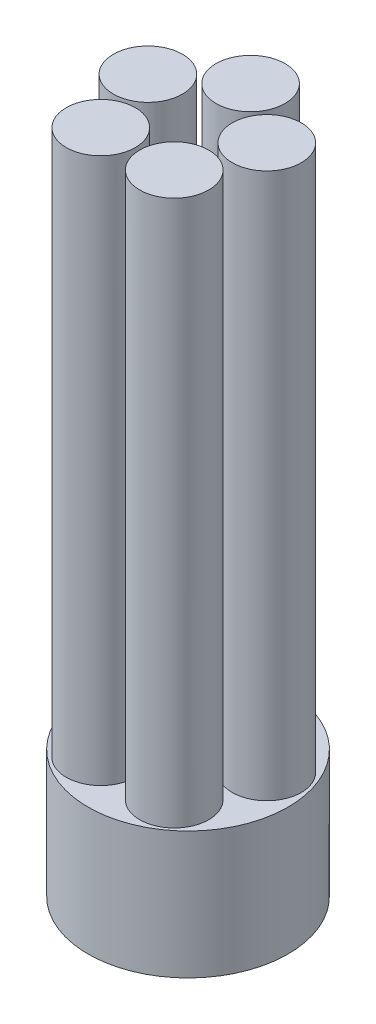
from build123d import *

# Parameters (mm, degrees)
SKETCH1_R             = 38
BOSS_EXTRUDE1_DEPTH   = 600
BOSS_EXTRUDE1_2_DEPTH = 600
BOSS_EXTRUDE1_3_DEPTH = 600
BOSS_EXTRUDE1_4_DEPTH = 600
BOSS_EXTRUDE1_5_DEPTH = 600
SKETCH2_R             = 110
BOSS_EXTRUDE2_DEPTH   = 140


with BuildPart() as part:
    # Sketch1 → Boss-Extrude1 (new body)
    with BuildSketch(Plane(origin=(0, 0, 0), x_dir=(1, 0, 0), z_dir=(0, 1, 0))):
        with Locations(Location((65.370232552, 21.240076103, 0), (0, 0, 270))):
            Circle(SKETCH1_R)
    extrude(amount=BOSS_EXTRUDE1_DEPTH)



with BuildPart() as body_2:
    # Sketch1 → Boss-Extrude1 2 (new body)
    with BuildSketch(Plane(origin=(0, 0, 0), x_dir=(1, 0, 0), z_dir=(0, 1, 0))):
        with Locations(Location((40.401025569, -55.607241162, 0), (0, 0, 270))):
            Circle(SKETCH1_R)
    extrude(amount=BOSS_EXTRUDE1_2_DEPTH)


with BuildPart() as body_3:
    # Sketch1 → Boss-Extrude1 3 (new body)
    with BuildSketch(Plane(origin=(0, 0, 0), x_dir=(1, 0, 0), z_dir=(0, 1, 0))):
        with Locations(Location((-40.401025569, -55.607241162, 0), (0, 0, 270))):
            Circle(SKETCH1_R)
    extrude(amount=BOSS_EXTRUDE1_3_DEPTH)


with BuildPart() as body_4:
    # Sketch1 → Boss-Extrude1 4 (new body)
    with BuildSketch(Plane(origin=(0, 0, 0), x_dir=(1, 0, 0), z_dir=(0, 1, 0))):
        with Locations(Location((-65.370232552, 21.240076103, 0), (0, 0, 270))):
            Circle(SKETCH1_R)
    extrude(amount=BOSS_EXTRUDE1_4_DEPTH)


with BuildPart() as body_5:
    # Sketch1 → Boss-Extrude1 5 (new body)
    with BuildSketch(Plane(origin=(0, 0, 0), x_dir=(1, 0, 0), z_dir=(0, 1, 0))):
        with Locations(Location((0, 68.734330118, 0), (0, 0, 270))):
            Circle(SKETCH1_R)
    extrude(amount=BOSS_EXTRUDE1_5_DEPTH)


with BuildPart() as part_1:
    add(part.part)

    add(body_2.part)  # Boss-Extrude2 merges body 2

    add(body_3.part)  # Boss-Extrude2 merges body 3

    add(body_4.part)  # Boss-Extrude2 merges body 4

    add(body_5.part)  # Boss-Extrude2 merges body 5
    # Sketch2 → Boss-Extrude2 (add)
    with BuildSketch(Plane.XZ):
        with Locations(Location((0, 0, 0), (0, 0, 270))):
            Circle(SKETCH2_R)
    extrude(amount=BOSS_EXTRUDE2_DEPTH)


solid = part_1.part
